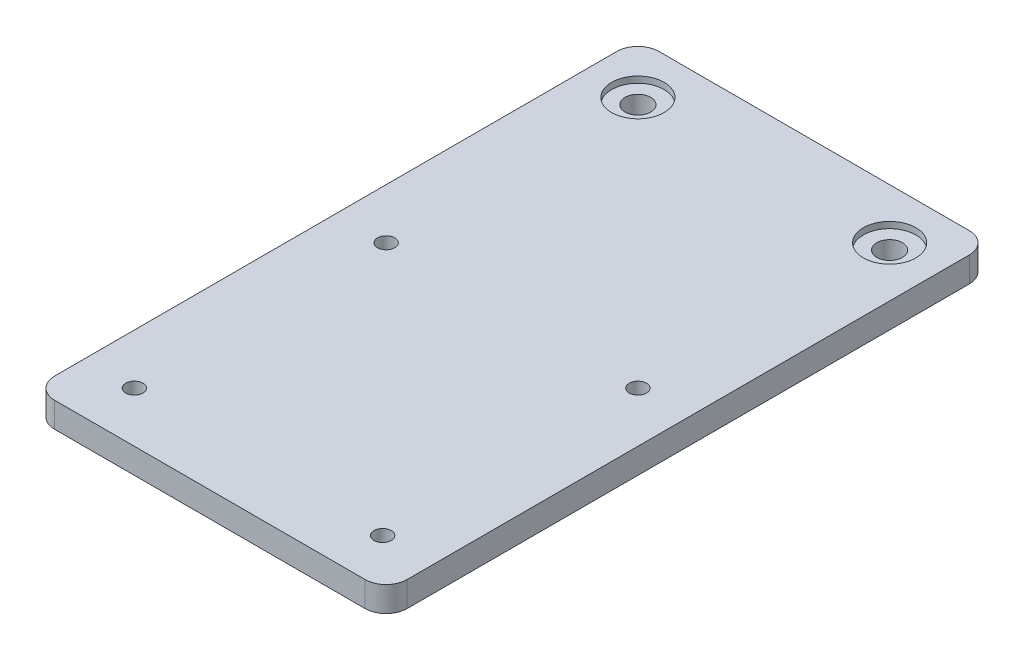
from build123d import *

# Parameters (mm, degrees)
EXTRUDE_1_DEPTH     = 6
SKETCH_2_R          = 2.05
SKETCH_2_R_2        = 3.05
CUT_EXTRUDE_1_DEPTH = 6
SKETCH_3_R          = 5.25
CUT_EXTRUDE_2_DEPTH = 1.3
SKETCH_5_R          = 6.25
CUT_EXTRUDE_3_DEPTH = 1.5


with BuildPart() as part:
    # 草图1 → 凸台-拉伸1 (new body)
    with BuildSketch(Plane(origin=(0, 0, 0), x_dir=(1, 0, 0), z_dir=(0, 1, 0))):
        with BuildLine():
            Line((37, -72), (-37, -72))
            ThreePointArc((-37, -72), (-40.535533906, -70.535533906), (-42, -67))
            Line((-42, -67), (-42, 67))
            ThreePointArc((-42, 67), (-40.535533906, 70.535533906), (-37, 72))
            Line((-37, 72), (37, 72))
            ThreePointArc((37, 72), (40.535533906, 70.535533906), (42, 67))
            Line((42, 67), (42, -67))
            ThreePointArc((42, -67), (40.535533906, -70.535533906), (37, -72))
        make_face()
    extrude(amount=EXTRUDE_1_DEPTH)

    # 草图2 → 切除-拉伸1 (cut)
    with BuildSketch(Plane.XZ):
        with Locations(Location((-30, 60, 0), (0, 0, 270))):
            Circle(SKETCH_2_R)
        with Locations(Location((30, 60.83466259, 0), (0, 0, 270))):
            Circle(SKETCH_2_R)
        with Locations(Location((-30, 0, 0), (0, 0, 270))):
            Circle(SKETCH_2_R)
        with Locations(Location((30, 0, 0), (0, 0, 270))):
            Circle(SKETCH_2_R)
        with Locations(Location((-30, -60, 0), (0, 0, 270))):
            Circle(SKETCH_2_R_2)
        with Locations(Location((30, -60, 0), (0, 0, 270))):
            Circle(SKETCH_2_R_2)
    extrude(amount=-CUT_EXTRUDE_1_DEPTH, mode=Mode.SUBTRACT)

    # 草图3 → 切除-拉伸2 (cut)
    with BuildSketch(Plane.XZ):
        with Locations(Location((-30, 60, 0), (0, 0, 270))):
            Circle(SKETCH_3_R)
        with Locations(Location((30, 60.83466259, 0), (0, 0, 270))):
            Circle(SKETCH_3_R)
        with Locations(Location((-30, 0, 0), (0, 0, 270))):
            Circle(SKETCH_3_R)
        with Locations(Location((30, 0, 0), (0, 0, 270))):
            Circle(SKETCH_3_R)
    extrude(amount=-CUT_EXTRUDE_2_DEPTH, mode=Mode.SUBTRACT)

    # 草图5 → 切除-拉伸3 (cut)
    with BuildSketch(Plane(origin=(0, 6, 0), x_dir=(1, 0, 0), z_dir=(0, 1, 0))):
        with Locations(Location((-30, 60, 0), (0, 0, 270))):
            Circle(SKETCH_5_R)
        with Locations(Location((30, 60, 0), (0, 0, 270))):
            Circle(SKETCH_5_R)
    extrude(amount=-CUT_EXTRUDE_3_DEPTH, mode=Mode.SUBTRACT)


solid = part.part
